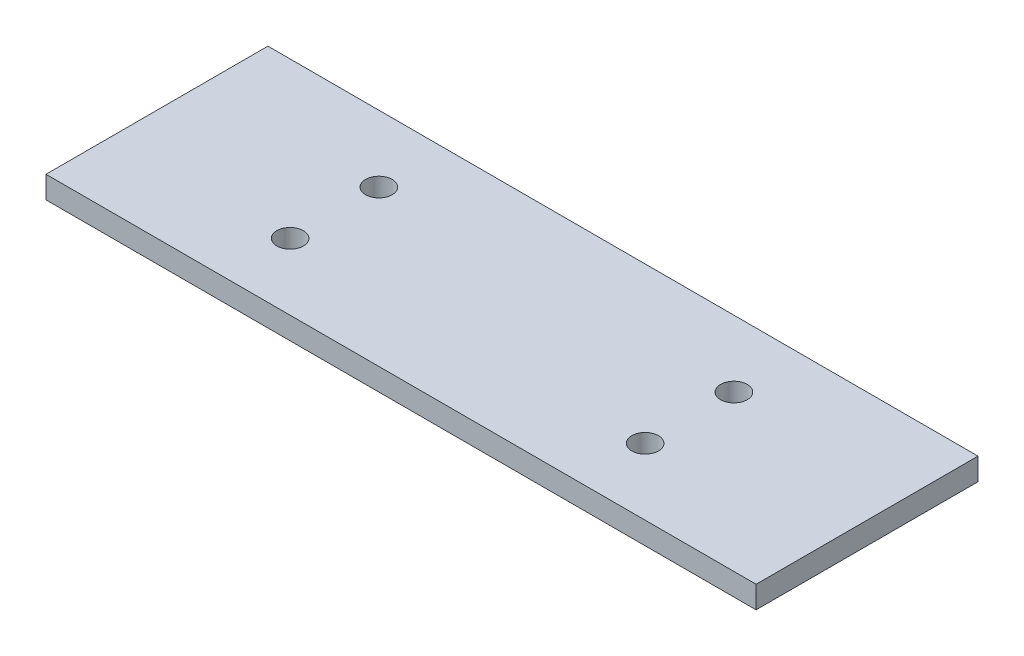
from build123d import *

# Parameters (mm, degrees)
SKIZZE1_W                       = 160
SKIZZE1_H                       = 50
SKIZZE1_R                       = 3
AUFSATZ_LINEAR_AUSTRAGEN1_DEPTH = 5


with BuildPart() as part:
    # Skizze1 → Aufsatz-Linear austragen1 (new body)
    with BuildSketch(Plane(origin=(0, 0, 0), x_dir=(1, 0, 0), z_dir=(0, 1, 0))):
        Rectangle(SKIZZE1_W, SKIZZE1_H)
        with Locations(Location((-40, 10, 0), (0, 0, 270))):
            Circle(SKIZZE1_R, mode=Mode.SUBTRACT)
        with Locations(Location((-40, -10, 0), (0, 0, 270))):
            Circle(SKIZZE1_R, mode=Mode.SUBTRACT)
        with Locations(Location((40, 10, 0), (0, 0, 270))):
            Circle(SKIZZE1_R, mode=Mode.SUBTRACT)
        with Locations(Location((40, -10, 0), (0, 0, 270))):
            Circle(SKIZZE1_R, mode=Mode.SUBTRACT)
    extrude(amount=AUFSATZ_LINEAR_AUSTRAGEN1_DEPTH)


solid = part.part
